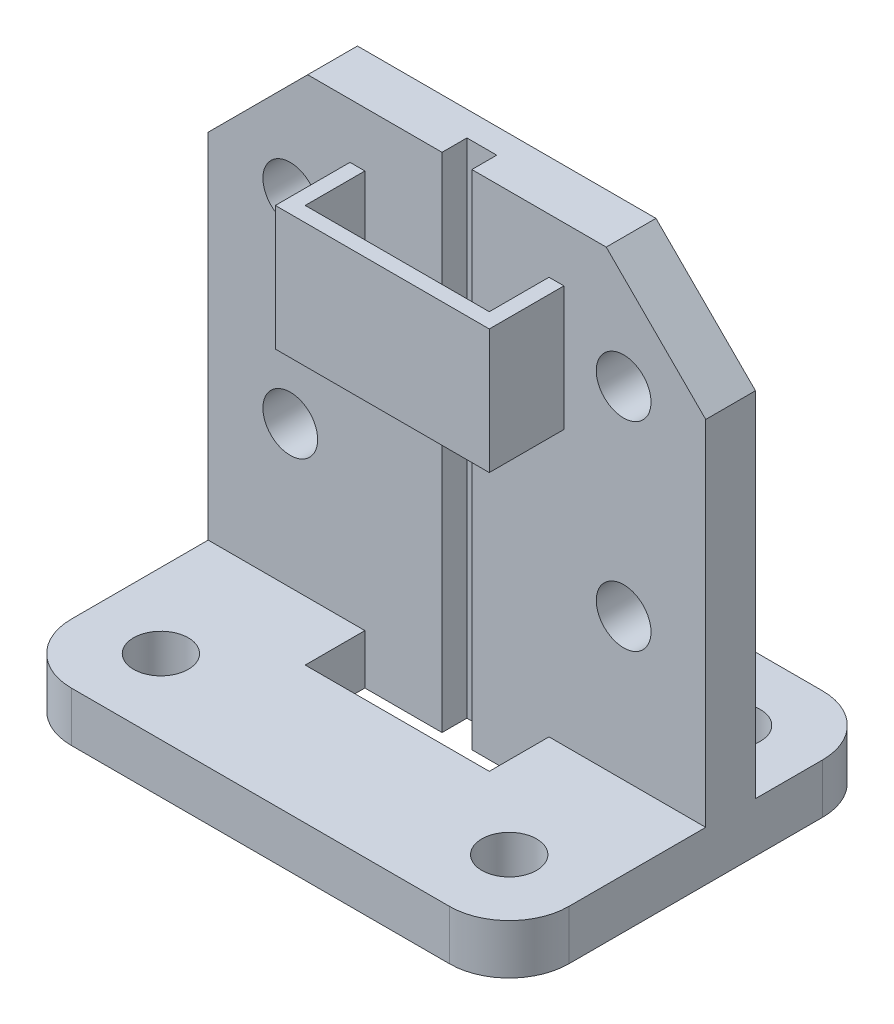
from build123d import *

# Parameters (mm, degrees)
SKETCH1_W           = 25.4
SKETCH1_H           = 21.59
SKETCH1_R           = 1.397
BOSS_EXTRUDE1_DEPTH = 2.54
SKETCH2_W           = 1.524
SKETCH2_H           = 21.59
CUT_EXTRUDE1_DEPTH  = 1.27
BOSS_EXTRUDE3_DEPTH = 1.524
SKETCH8_W           = 25.4
SKETCH8_H           = 19.05
SKETCH8_R           = 1.397
BOSS_EXTRUDE4_DEPTH = 2.54
CUT_EXTRUDE2_DEPTH  = 15.24
CUT_EXTRUDE3_DEPTH  = 15.24
BOSS_EXTRUDE5_DEPTH = 6.35
CHAMFER1_SIZE       = 5.08
FILLET1_R           = 3.048


with BuildPart() as part:
    # Sketch1 → Boss-Extrude1 (new body)
    with BuildSketch(Plane.XY):
        Rectangle(SKETCH1_W, SKETCH1_H)
        with Locations((-8.509, 5.08)):
            Circle(SKETCH1_R, mode=Mode.SUBTRACT)
        with Locations((8.509, 5.08)):
            Circle(SKETCH1_R, mode=Mode.SUBTRACT)
        with Locations((8.509, -5.08)):
            Circle(SKETCH1_R, mode=Mode.SUBTRACT)
        with Locations((-8.509, -5.08)):
            Circle(SKETCH1_R, mode=Mode.SUBTRACT)
    extrude(amount=BOSS_EXTRUDE1_DEPTH)

    # Sketch2 → Cut-Extrude1 (cut)
    with BuildSketch(Plane.XY.offset(2.54)):
        Rectangle(SKETCH2_W, SKETCH2_H)
    extrude(amount=-CUT_EXTRUDE1_DEPTH, mode=Mode.SUBTRACT)

    # Sketch7 → Boss-Extrude3 (add)
    with BuildSketch(Plane.XZ.offset(10.795)):
        Polygon((-0.762, 2.54), (-12.7, 2.54), (-12.7, 0), (12.7, 0), (12.7, 2.54), (0.762, 2.54), (0.762, 1.27), (-0.762, 1.27), align=None)
    extrude(amount=BOSS_EXTRUDE3_DEPTH)

    # Sketch8 → Boss-Extrude4 (add)
    with BuildSketch(Plane.XZ.offset(12.319)):
        with Locations((0, 3.048)):
            Rectangle(SKETCH8_W, SKETCH8_H)
        with Locations(Location((-8.89, 8.763, 0), (0, 0, 270))):
            Circle(SKETCH8_R, mode=Mode.SUBTRACT)
        with Locations(Location((8.89, 8.763, 0), (0, 0, 270))):
            Circle(SKETCH8_R, mode=Mode.SUBTRACT)
        with Locations(Location((-8.89, -2.667, 0), (0, 0, 270))):
            Circle(SKETCH8_R, mode=Mode.SUBTRACT)
        with Locations(Location((8.89, -2.667, 0), (0, 0, 270))):
            Circle(SKETCH8_R, mode=Mode.SUBTRACT)
    extrude(amount=BOSS_EXTRUDE4_DEPTH)

    # Sketch5 → Cut-Extrude2 (cut)
    with BuildSketch(Plane(origin=(0, -1.905, 0), x_dir=(-1, 0, 0), z_dir=(0, -1, 0))):
        Polygon((-4.445, -2.54), (-4.445, -5.334), (4.445, -5.334), (4.445, -2.54), (4.699, -2.54), (4.699, -5.588), (-4.699, -5.588), (-4.699, -2.54), align=None)
    extrude(amount=CUT_EXTRUDE2_DEPTH, mode=Mode.SUBTRACT)

    # Sketch9 → Cut-Extrude3 (cut)
    with BuildSketch(Plane(origin=(0, -12.319, 0), x_dir=(1, 0, 0), z_dir=(0, 1, 0))):
        Polygon((-0.762, -1.27), (0.762, -1.27), (0.762, -2.54), (4.445, -2.54), (4.445, -5.334), (-4.445, -5.334), (-4.445, -2.54), (-0.762, -2.54), align=None)
    extrude(amount=-CUT_EXTRUDE3_DEPTH, mode=Mode.SUBTRACT)

    # Sketch11 → Boss-Extrude5 (add)
    with BuildSketch(Plane(origin=(0, 1.651, 0), x_dir=(1, 0, 0), z_dir=(0, 1, 0))):
        Polygon((-4.699, -2.54), (-5.461, -2.54), (-5.461, -6.35), (5.461, -6.35), (5.461, -2.54), (4.699, -2.54), (4.699, -5.588), (-4.699, -5.588), align=None)
    extrude(amount=BOSS_EXTRUDE5_DEPTH)

    # Chamfer1
    chamfer1_edges = [part.edges().sort_by_distance(p)[0] for p in [
        (-12.7, 10.795, 1.27),
        (12.7, 10.795, 1.27),
    ]]
    chamfer(chamfer1_edges, length=CHAMFER1_SIZE)

    # Fillet1
    fillet1_edges = [part.edges().sort_by_distance(p)[0] for p in [
        (-12.7, -13.589, 12.573),
        (-12.7, -13.589, -6.477),
        (12.7, -13.589, -6.477),
        (12.7, -13.589, 12.573),
    ]]
    fillet(fillet1_edges, radius=FILLET1_R)


solid = part.part
